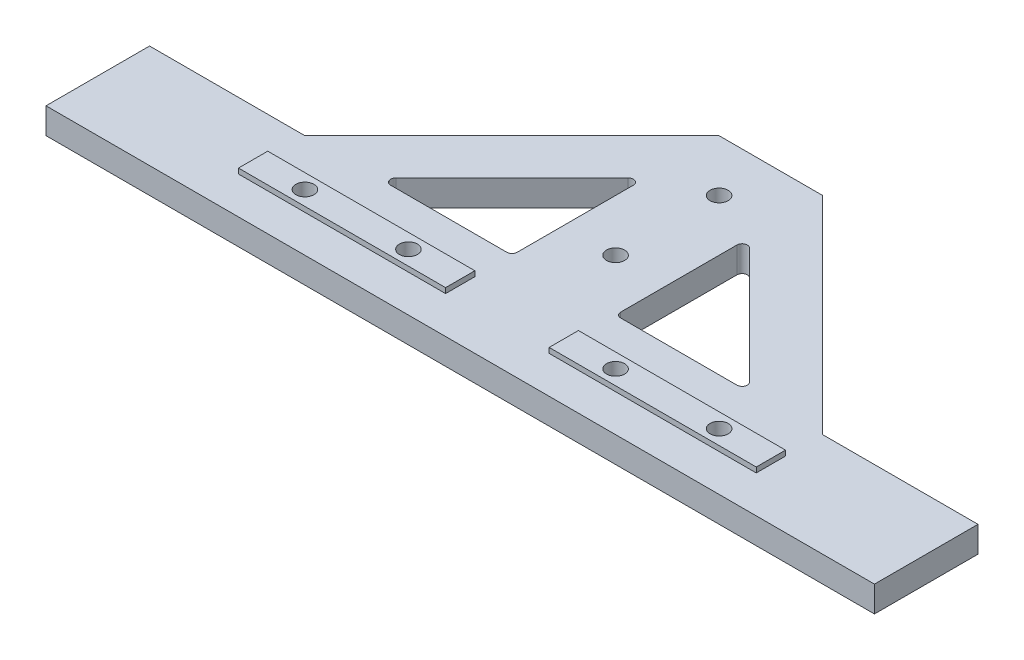
from build123d import *

# Parameters (mm, degrees)
ESBO_O1_R                = 1.75
RESSALTO_EXTRUS_O1_DEPTH = 5
ESBO_O3_W                = 40
ESBO_O3_H                = 5.65
ESBO_O3_R                = 1.75
RESSALTO_EXTRUS_O2_DEPTH = 1
ESBO_O4_W                = 30
ESBO_O4_H                = 20.000002677
RESSALTO_EXTRUS_O3_DEPTH = 5


with BuildPart() as part:
    # Esboço1 → Ressalto-extrusão1 (new body)
    with BuildSketch(Plane(origin=(0, 0, 0), x_dir=(1, 0, 0), z_dir=(0, 1, 0))):
        Polygon((-50, 0), (-50, 20.000002677), (-9.999996661, 60.000002546), (9.999996661, 60.000002546), (50, 20.000002677), (50, 0), align=None)
        with Locations(Location((-40, 10.000001339, 0), (0, 0, 270))):
            Circle(ESBO_O1_R, mode=Mode.SUBTRACT)
        with Locations(Location((-20, 10.000001339, 0), (0, 0, 270))):
            Circle(ESBO_O1_R, mode=Mode.SUBTRACT)
        with Locations(Location((0, 50.000002546, 0), (0, 0, 270))):
            Circle(ESBO_O1_R, mode=Mode.SUBTRACT)
        with Locations(Location((0, 30.000002546, 0), (0, 0, 270))):
            Circle(ESBO_O1_R, mode=Mode.SUBTRACT)
        with Locations(Location((20, 10.000001339, 0), (0, 0, 90))):
            Circle(ESBO_O1_R, mode=Mode.SUBTRACT)
        with Locations(Location((40, 10.000001339, 0), (0, 0, 90))):
            Circle(ESBO_O1_R, mode=Mode.SUBTRACT)
        with BuildLine():
            Line((-10, 43.443650782), (-10, 21.000001339))
            ThreePointArc((-10, 21.000001339), (-10.292893219, 20.292894558), (-11, 20.000001339))
            Line((-11, 20.000001339), (-33.443651391, 20.000001339))
            ThreePointArc((-33.443651391, 20.000001339), (-34.367530932, 20.617317926), (-34.150758141, 21.707108151))
            Line((-34.150758141, 21.707108151), (-11.707106751, 44.150757594))
            ThreePointArc((-11.707106751, 44.150757594), (-10.617316548, 44.367530307), (-10, 43.443650782))
        make_face(mode=Mode.SUBTRACT)
        with BuildLine():
            Line((11.707106751, 44.150757594), (34.150758141, 21.707108151))
            ThreePointArc((34.150758141, 21.707108151), (34.367530932, 20.617317926), (33.443651391, 20.000001339))
            Line((33.443651391, 20.000001339), (11, 20.000001339))
            ThreePointArc((11, 20.000001339), (10.292893219, 20.292894558), (10, 21.000001339))
            Line((10, 21.000001339), (10, 43.443650782))
            ThreePointArc((10, 43.443650782), (10.617316548, 44.367530307), (11.707106751, 44.150757594))
        make_face(mode=Mode.SUBTRACT)
    extrude(amount=RESSALTO_EXTRUS_O1_DEPTH)

    # Esboço3 → Ressalto-extrusão2 (add)
    # profile 1 of 2: a face of its own
    with BuildSketch(Plane(origin=(0, 5, 0), x_dir=(1, 0, 0), z_dir=(0, 1, 0))):
        with Locations((-30, 10.000001339)):
            Rectangle(ESBO_O3_W, ESBO_O3_H)
        with Locations(Location((-40, 10.000001339, 0), (0, 0, 270))):
            Circle(ESBO_O3_R, mode=Mode.SUBTRACT)
        with Locations(Location((-20, 10.000001339, 0), (0, 0, 270))):
            Circle(ESBO_O3_R, mode=Mode.SUBTRACT)
    # profile 2 of 2: a face of its own
    with BuildSketch(Plane(origin=(0, 5, 0), x_dir=(1, 0, 0), z_dir=(0, 1, 0))):
        with Locations((30, 10.000001339)):
            Rectangle(ESBO_O3_W, ESBO_O3_H)
        with Locations(Location((20, 10.000001339, 0), (0, 0, 90))):
            Circle(ESBO_O3_R, mode=Mode.SUBTRACT)
        with Locations(Location((40, 10.000001339, 0), (0, 0, 90))):
            Circle(ESBO_O3_R, mode=Mode.SUBTRACT)
    extrude(amount=RESSALTO_EXTRUS_O2_DEPTH)

    # Esboço4 → Ressalto-extrusão3 (add)
    with BuildSketch(Plane.XZ):
        with Locations((-65, -10.000001339)):
            Rectangle(ESBO_O4_W, ESBO_O4_H)
        with Locations((65, -10.000001339)):
            Rectangle(ESBO_O4_W, ESBO_O4_H)
    extrude(amount=-RESSALTO_EXTRUS_O3_DEPTH)


solid = part.part
